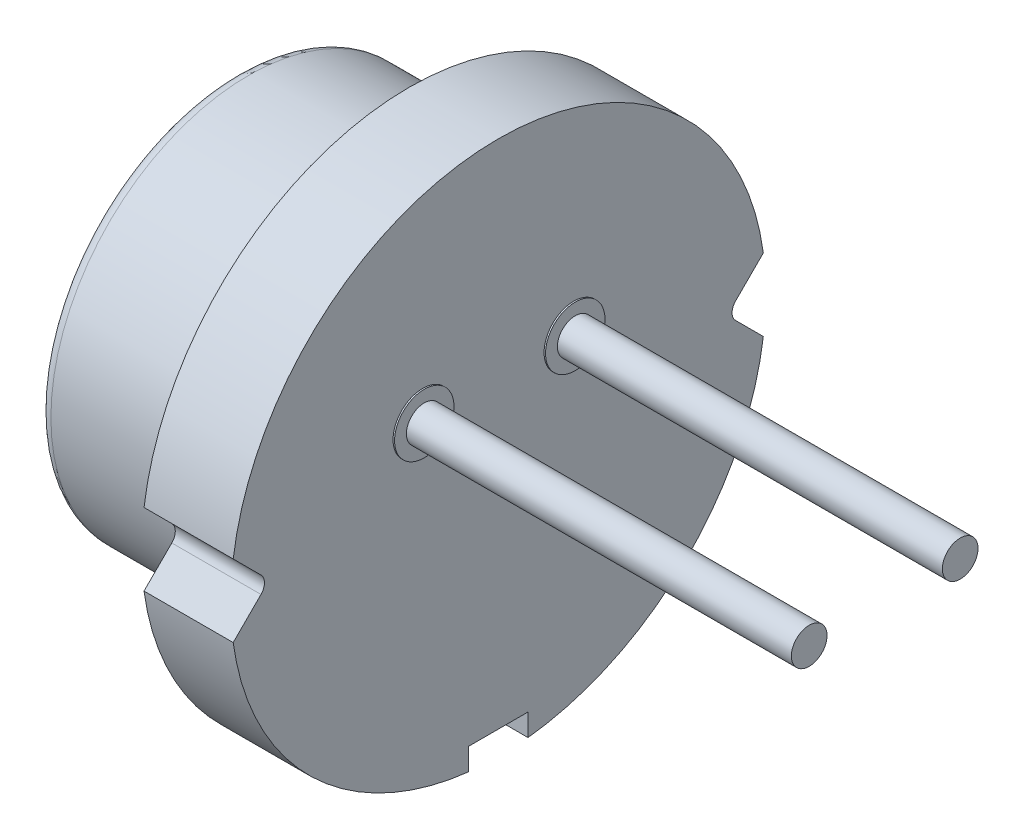
from build123d import *

# Parameters (mm, degrees)
SKETCH6_R             = 0.3
EXTRUDE2_DEPTH        = 6.5
SKETCH13_R            = 0.5
SKETCH13_R_2          = 0.3
BOSS_EXTRUDE5_DEPTH   = 0.025
BOSS_EXTRUDE5_2_DEPTH = 0.025
SKETCH11_W            = 4.454312554
SKETCH11_H            = 1.858889087
BOSS_EXTRUDE3_DEPTH   = 1.96
SKETCH12_W            = 1
SKETCH12_H            = 0.1
BOSS_EXTRUDE4_DEPTH   = 1.5
CUT_EXTRUDE2_DEPTH    = 10.096702699
FILLET7_R             = 0.2
FILLET8_R             = 0.2


with BuildPart() as part:
    # Sketch4 → Revolve2 (revolve)
    with BuildSketch(Plane.XY):
        Polygon((0, 3.318708392), (0, 0), (1.5, 0), (1.5, 4.5), (0, 4.5), (0, 3.65), align=None)
    revolve(axis=Axis((-2.49171246, 0, 0), (1, 0, 0)))

    # Sketch6 → Extrude2 (add)
    with BuildSketch(Plane(origin=(1.5, 0, 0), x_dir=(0, 0, -1), z_dir=(1, 0, 0))):
        with Locations((-1.27, 1)):
            Circle(SKETCH6_R)
        with Locations((1.27, 1)):
            Circle(SKETCH6_R)
    extrude(amount=EXTRUDE2_DEPTH)

    # Sketch11 → Boss-Extrude3 (add)
    with BuildSketch(Plane.ZY):
        with Locations((0, -1.029444544)):
            Rectangle(SKETCH11_W, SKETCH11_H)
    extrude(amount=BOSS_EXTRUDE3_DEPTH)

    # Sketch8 → Cut-Extrude2 (cut, through all)
    with BuildSketch(Plane(origin=(1.5, 0, 0), x_dir=(0, 0, -1), z_dir=(1, 0, 0))):
        with BuildLine():
            Line((4.458648555, 0.608648555), (3.85, 0))
            Line((3.85, 0), (4.458648555, -0.608648555))
            ThreePointArc((4.458648555, -0.608648555), (4.5, 0), (4.458648555, 0.608648555))
        make_face()
        with BuildLine():
            Line((-3.85, 0), (-4.458648555, 0.608648555))
            ThreePointArc((-4.458648555, 0.608648555), (-4.5, 0), (-4.458648555, -0.608648555))
            Line((-4.458648555, -0.608648555), (-3.85, 0))
        make_face()
        with BuildLine():
            ThreePointArc((-0.5, -4.472135955), (0, -4.5), (0.5, -4.472135955))
            Line((0.5, -4.472135955), (0.5, -4.1))
            Line((0.5, -4.1), (-0.5, -4.1))
            Line((-0.5, -4.1), (-0.5, -4.472135955))
        make_face()
    extrude(amount=-CUT_EXTRUDE2_DEPTH, mode=Mode.SUBTRACT)

    # Fillet7
    fillet7_edges = [part.edges().sort_by_distance(p)[0] for p in [
        (0.75, 0, 3.85),
        (0.75, 0, -3.85),
    ]]
    fillet(fillet7_edges, radius=FILLET7_R)


with BuildPart() as body_2:
    # Sketch4<5> → Revolve3 (revolve)
    with BuildSketch(Plane.XY):
        with BuildLine():
            Line((-0.027565235, 3.318708392), (0, 3.318708392))
            Line((0, 3.318708392), (0, 3.65))
            Line((0, 3.65), (-0.2, 3.65))
            Line((-0.2, 3.65), (-0.2, 3.575))
            ThreePointArc((-0.2, 3.575), (-0.273223305, 3.398223305), (-0.45, 3.325))
            Line((-0.45, 3.325), (-2.9, 3.325))
            Line((-2.9, 3.325), (-2.9, 0.75))
            Line((-2.9, 0.75), (-2.7, 0.75))
            Line((-2.7, 0.75), (-2.7, 3.125))
            Line((-2.7, 3.125), (-0.541893018, 3.125))
            ThreePointArc((-0.541893018, 3.125), (-0.267094906, 3.175032427), (-0.027565235, 3.318708392))
        make_face()
    revolve(axis=Axis((-2.49171246, 0, 0), (1, 0, 0)))

    # Fillet8
    fillet8_edges = [body_2.edges().sort_by_distance(p)[0] for p in [
        (-2.9, -3.325, 0),
    ]]
    fillet(fillet8_edges, radius=FILLET8_R)


with BuildPart() as body_3:
    # Sketch13 → Boss-Extrude5 (new, symmetric)
    with BuildSketch(Plane(origin=(1.5, 0, 0), x_dir=(0, 0, -1), z_dir=(1, 0, 0))):
        with Locations((-1.27, 1)):
            Circle(SKETCH13_R)
        with Locations((-1.27, 1)):
            Circle(SKETCH13_R_2, mode=Mode.SUBTRACT)
    extrude(amount=BOSS_EXTRUDE5_DEPTH, both=True)


with BuildPart() as body_4:
    # Sketch13 → Boss-Extrude5 2 (new, symmetric)
    with BuildSketch(Plane(origin=(1.5, 0, 0), x_dir=(0, 0, -1), z_dir=(1, 0, 0))):
        with Locations((1.27, 1)):
            Circle(SKETCH13_R)
        with Locations((1.27, 1)):
            Circle(SKETCH13_R_2, mode=Mode.SUBTRACT)
    extrude(amount=BOSS_EXTRUDE5_2_DEPTH, both=True)


with BuildPart() as body_5:
    # Sketch12 → Boss-Extrude4 (new body)
    with BuildSketch(Plane.ZY.offset(1.96)):
        with Locations((0, -0.05)):
            Rectangle(SKETCH12_W, SKETCH12_H)
    extrude(amount=-BOSS_EXTRUDE4_DEPTH)


solid = Compound([part.part, body_2.part, body_3.part, body_4.part, body_5.part])
